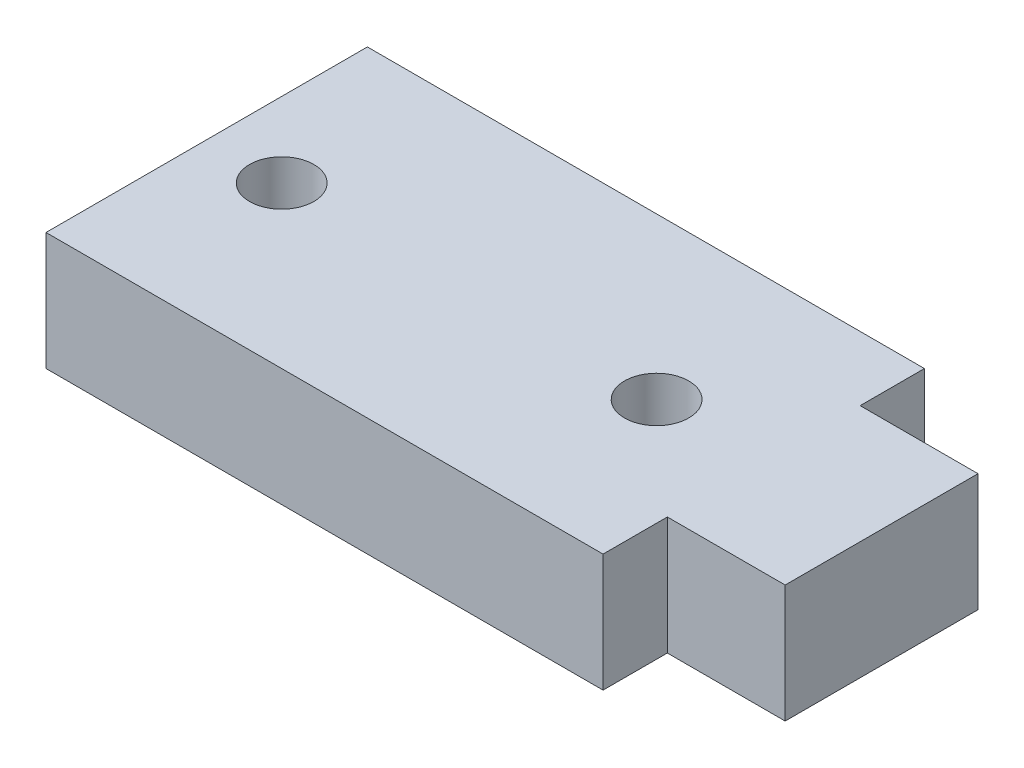
from build123d import *

# Parameters (mm, degrees)
CROQUIS1_R              = 1.5
SALIENTE_EXTRUIR1_DEPTH = 5.5


with BuildPart() as part:
    # Croquis1 → Saliente-Extruir1 (new body)
    with BuildSketch(Plane(origin=(0, 0, 0), x_dir=(1, 0, 0), z_dir=(0, 1, 0))):
        Polygon((-70.318181818, 9.704545455), (-44.318181818, 9.704545455), (-44.318181818, 6.704545455), (-38.818181818, 6.704545455), (-38.818181818, -2.295454545), (-44.318181818, -2.295454545), (-44.318181818, -5.295454545), (-70.318181818, -5.295454545), align=None)
        with Locations(Location((-66.818181818, 2.204545455, 0), (0, 0, 270))):
            Circle(CROQUIS1_R, mode=Mode.SUBTRACT)
        with Locations(Location((-49.318181818, 2.204545455, 0), (0, 0, 270))):
            Circle(CROQUIS1_R, mode=Mode.SUBTRACT)
    extrude(amount=SALIENTE_EXTRUIR1_DEPTH)


solid = part.part
